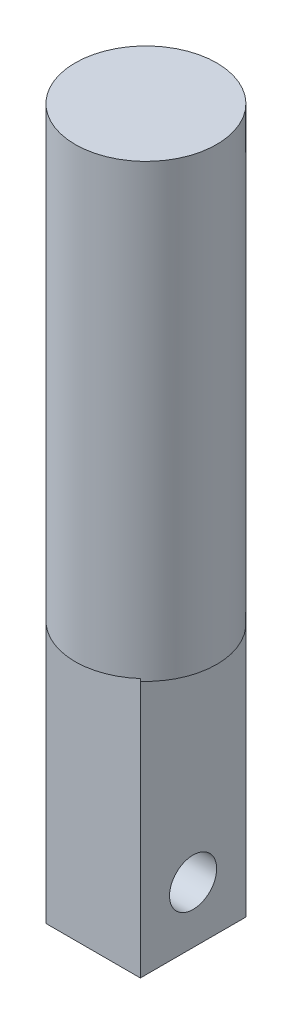
from build123d import *

# Parameters (mm, degrees)
SKETCH2_R           = 15
BOSS_EXTRUDE1_DEPTH = 150
CUT_EXTRUDE1_START  = 10
SKETCH3_W           = 30
SKETCH3_H           = 108.98871412
CUT_EXTRUDE1_DEPTH  = 100
CUT_EXTRUDE2_START  = -10
SKETCH3_2_W         = 30
SKETCH3_2_H         = 108.98871412
CUT_EXTRUDE2_DEPTH  = 100
SKETCH4_R           = 5
CUT_EXTRUDE3_DEPTH  = 100
CUT_EXTRUDE4_DEPTH  = 55


with BuildPart() as part:
    # Sketch2 → Boss-Extrude1 (new body)
    with BuildSketch(Plane(origin=(0, 0, 0), x_dir=(1, 0, 0), z_dir=(0, 1, 0))):
        Circle(SKETCH2_R)
    extrude(amount=BOSS_EXTRUDE1_DEPTH)

    # Sketch3 → Cut-Extrude1 (cut)
    with BuildSketch(Plane(origin=(0, 0, 0), x_dir=(0, 0, -1), z_dir=(1, 0, 0)).offset(CUT_EXTRUDE1_START)):
        Rectangle(SKETCH3_W, SKETCH3_H)
    extrude(amount=CUT_EXTRUDE1_DEPTH, mode=Mode.SUBTRACT)

    # Sketch3<2> → Cut-Extrude2 (cut)
    with BuildSketch(Plane(origin=(0, 0, 0), x_dir=(0, 0, -1), z_dir=(1, 0, 0)).offset(CUT_EXTRUDE2_START)):
        Rectangle(SKETCH3_2_W, SKETCH3_2_H)
    extrude(amount=-CUT_EXTRUDE2_DEPTH, mode=Mode.SUBTRACT)

    # Sketch4 → Cut-Extrude3 (cut)
    with BuildSketch(Plane(origin=(10, 0, 0), x_dir=(0, 0, -1), z_dir=(1, 0, 0))):
        with Locations((0.000339887, 12)):
            Circle(SKETCH4_R)
    extrude(amount=-CUT_EXTRUDE3_DEPTH, mode=Mode.SUBTRACT)

    # Sketch5 → Cut-Extrude4 (cut)
    with BuildSketch(Plane.XZ):
        with BuildLine():
            Line((-10, 11.180339887), (10, 11.180339887))
            ThreePointArc((10, 11.180339887), (0, 15), (-10, 11.180339887))
        make_face()
        with BuildLine():
            Line((-10, -11.180339887), (10, -11.180339887))
            ThreePointArc((10, -11.180339887), (0, -15), (-10, -11.180339887))
        make_face()
    extrude(amount=-CUT_EXTRUDE4_DEPTH, mode=Mode.SUBTRACT)


solid = part.part
